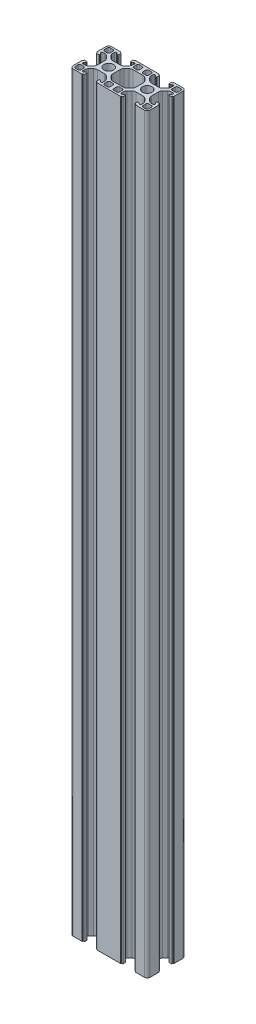
from build123d import *

# Parameters (mm, degrees)
EXTRUDE_1_DEPTH = 390


with BuildPart() as part:
    # Эскиз1 → Бобышка-Вытянуть1 (new body)
    with BuildSketch(Plane(origin=(0, 0, 0), x_dir=(1, 0, 0), z_dir=(0, 1, 0))):
        with BuildLine():
            Line((9.247825015, 4.683728486), (11.146605684, 4.683728486))
            ThreePointArc((11.146605684, 4.683728486), (11.911972549, 4.835969421), (12.560819246, 5.269514923))
            Line((12.560819246, 5.269514923), (13.862038577, 6.570734254))
            ThreePointArc((13.862038577, 6.570734254), (14.29558408, 7.219580952), (14.447825015, 7.984947817))
            Line((14.447825015, 7.984947817), (14.447825015, 8.883728486))
            ThreePointArc((14.447825015, 8.883728486), (14.301378405, 9.237281876), (13.947825015, 9.383728486))
            Line((13.947825015, 9.383728486), (13.844931796, 9.383728486))
            ThreePointArc((13.844931796, 9.383728486), (13.65359008, 9.345668252), (13.491378405, 9.237281876))
            Line((13.491378405, 9.237281876), (13.01104832, 8.75695179))
            ThreePointArc((13.01104832, 8.75695179), (12.929942482, 8.702758603), (12.834271624, 8.683728486))
            Line((12.834271624, 8.683728486), (12.547825015, 8.683728486))
            ThreePointArc((12.547825015, 8.683728486), (12.37104832, 8.75695179), (12.297825015, 8.933728486))
            Line((12.297825015, 8.933728486), (12.297825015, 10.082799306))
            ThreePointArc((12.297825015, 10.082799306), (12.341758998, 10.188865323), (12.447825015, 10.232799306))
            Line((12.447825015, 10.232799306), (12.947825015, 10.232799306))
            Line((12.947825015, 10.232799306), (12.947825015, 10.533728486))
            ThreePointArc((12.947825015, 10.533728486), (12.991758998, 10.639794503), (13.097825015, 10.683728486))
            Line((13.097825015, 10.683728486), (17.747825015, 10.683728486))
            ThreePointArc((17.747825015, 10.683728486), (18.808485187, 10.244388658), (19.247825015, 9.183728486))
            Line((19.247825015, 9.183728486), (19.247825015, 4.533728486))
            ThreePointArc((19.247825015, 4.533728486), (19.203891032, 4.427662469), (19.097825015, 4.383728486))
            Line((19.097825015, 4.383728486), (18.796895835, 4.383728486))
            Line((18.796895835, 4.383728486), (18.796895835, 3.883728486))
            ThreePointArc((18.796895835, 3.883728486), (18.752961853, 3.777662469), (18.646895835, 3.733728486))
            Line((18.646895835, 3.733728486), (17.497825015, 3.733728486))
            ThreePointArc((17.497825015, 3.733728486), (17.32104832, 3.80695179), (17.247825015, 3.983728486))
            Line((17.247825015, 3.983728486), (17.247825015, 4.270175095))
            ThreePointArc((17.247825015, 4.270175095), (17.266855132, 4.365845953), (17.32104832, 4.44695179))
            Line((17.32104832, 4.44695179), (17.801378405, 4.927281876))
            ThreePointArc((17.801378405, 4.927281876), (17.909764781, 5.089493551), (17.947825015, 5.280835267))
            Line((17.947825015, 5.280835267), (17.947825015, 5.383728486))
            ThreePointArc((17.947825015, 5.383728486), (17.801378405, 5.737281876), (17.447825015, 5.883728486))
            Line((17.447825015, 5.883728486), (16.549044346, 5.883728486))
            ThreePointArc((16.549044346, 5.883728486), (15.783677481, 5.731487551), (15.134830783, 5.297942048))
            Line((15.134830783, 5.297942048), (13.833611452, 3.996722717))
            ThreePointArc((13.833611452, 3.996722717), (13.40006595, 3.34787602), (13.247825015, 2.582509155))
            Line((13.247825015, 2.582509155), (13.247825015, 0.683728486))
            Line((13.247825015, 0.683728486), (13.247825015, -1.215052183))
            ThreePointArc((13.247825015, -1.215052183), (13.40006595, -1.980419048), (13.833611452, -2.629265746))
            Line((13.833611452, -2.629265746), (15.134830783, -3.930485077))
            ThreePointArc((15.134830783, -3.930485077), (15.783677481, -4.364030579), (16.549044346, -4.516271514))
            Line((16.549044346, -4.516271514), (17.447825015, -4.516271514))
            ThreePointArc((17.447825015, -4.516271514), (17.801378405, -4.369824905), (17.947825015, -4.016271514))
            Line((17.947825015, -4.016271514), (17.947825015, -3.913378295))
            ThreePointArc((17.947825015, -3.913378295), (17.909764781, -3.722036579), (17.801378405, -3.559824905))
            Line((17.801378405, -3.559824905), (17.32104832, -3.079494819))
            ThreePointArc((17.32104832, -3.079494819), (17.266855132, -2.998388982), (17.247825015, -2.902718124))
            Line((17.247825015, -2.902718124), (17.247825015, -2.616271514))
            ThreePointArc((17.247825015, -2.616271514), (17.32104832, -2.439494819), (17.497825015, -2.366271514))
            Line((17.497825015, -2.366271514), (18.646895835, -2.366271514))
            ThreePointArc((18.646895835, -2.366271514), (18.752961853, -2.410205497), (18.796895835, -2.516271514))
            Line((18.796895835, -2.516271514), (18.796895835, -3.016271514))
            Line((18.796895835, -3.016271514), (19.097825015, -3.016271514))
            ThreePointArc((19.097825015, -3.016271514), (19.203891032, -3.060205497), (19.247825015, -3.166271514))
            Line((19.247825015, -3.166271514), (19.247825015, -7.816271514))
            ThreePointArc((19.247825015, -7.816271514), (18.808485187, -8.876931686), (17.747825015, -9.316271514))
            Line((17.747825015, -9.316271514), (13.097825015, -9.316271514))
            ThreePointArc((13.097825015, -9.316271514), (12.991758998, -9.272337531), (12.947825015, -9.166271514))
            Line((12.947825015, -9.166271514), (12.947825015, -8.865342335))
            Line((12.947825015, -8.865342335), (12.447825015, -8.865342335))
            ThreePointArc((12.447825015, -8.865342335), (12.341758998, -8.821408352), (12.297825015, -8.715342335))
            Line((12.297825015, -8.715342335), (12.297825015, -7.566271514))
            ThreePointArc((12.297825015, -7.566271514), (12.37104832, -7.389494819), (12.547825015, -7.316271514))
            Line((12.547825015, -7.316271514), (12.834271624, -7.316271514))
            ThreePointArc((12.834271624, -7.316271514), (12.929942482, -7.335301631), (13.01104832, -7.389494819))
            Line((13.01104832, -7.389494819), (13.491378405, -7.869824905))
            ThreePointArc((13.491378405, -7.869824905), (13.65359008, -7.978211281), (13.844931796, -8.016271514))
            Line((13.844931796, -8.016271514), (13.947825015, -8.016271514))
            ThreePointArc((13.947825015, -8.016271514), (14.301378405, -7.869824905), (14.447825015, -7.516271514))
            Line((14.447825015, -7.516271514), (14.447825015, -6.617490845))
            ThreePointArc((14.447825015, -6.617490845), (14.29558408, -5.85212398), (13.862038577, -5.203277283))
            Line((13.862038577, -5.203277283), (12.560819246, -3.902057952))
            ThreePointArc((12.560819246, -3.902057952), (11.911972549, -3.468512449), (11.146605684, -3.316271514))
            Line((11.146605684, -3.316271514), (9.247825015, -3.316271514))
            Line((9.247825015, -3.316271514), (7.349044346, -3.316271514))
            ThreePointArc((7.349044346, -3.316271514), (6.583677481, -3.468512449), (5.934830783, -3.902057952))
            Line((5.934830783, -3.902057952), (4.633611452, -5.203277283))
            ThreePointArc((4.633611452, -5.203277283), (4.20006595, -5.85212398), (4.047825015, -6.617490845))
            Line((4.047825015, -6.617490845), (4.047825015, -7.516271514))
            ThreePointArc((4.047825015, -7.516271514), (4.194271624, -7.869824905), (4.547825015, -8.016271514))
            Line((4.547825015, -8.016271514), (4.650718234, -8.016271514))
            ThreePointArc((4.650718234, -8.016271514), (4.84205995, -7.978211281), (5.004271624, -7.869824905))
            Line((5.004271624, -7.869824905), (5.48460171, -7.389494819))
            ThreePointArc((5.48460171, -7.389494819), (5.565707547, -7.335301631), (5.661378405, -7.316271514))
            Line((5.661378405, -7.316271514), (5.947825015, -7.316271514))
            ThreePointArc((5.947825015, -7.316271514), (6.12460171, -7.389494819), (6.197825015, -7.566271514))
            Line((6.197825015, -7.566271514), (6.197825015, -8.715342335))
            ThreePointArc((6.197825015, -8.715342335), (6.153891032, -8.821408352), (6.047825015, -8.865342335))
            Line((6.047825015, -8.865342335), (5.547825015, -8.865342335))
            Line((5.547825015, -8.865342335), (5.547825015, -9.166271514))
            ThreePointArc((5.547825015, -9.166271514), (5.503891032, -9.272337531), (5.397825015, -9.316271514))
            Line((5.397825015, -9.316271514), (0.747825015, -9.316271514))
            Line((0.747825015, -9.316271514), (-2.252174985, -9.316271514))
            Line((-2.252174985, -9.316271514), (-6.902174985, -9.316271514))
            ThreePointArc((-6.902174985, -9.316271514), (-7.008241002, -9.272337531), (-7.052174985, -9.166271514))
            Line((-7.052174985, -9.166271514), (-7.052174985, -8.865342335))
            Line((-7.052174985, -8.865342335), (-7.552174985, -8.865342335))
            ThreePointArc((-7.552174985, -8.865342335), (-7.658241002, -8.821408352), (-7.702174985, -8.715342335))
            Line((-7.702174985, -8.715342335), (-7.702174985, -7.566271514))
            ThreePointArc((-7.702174985, -7.566271514), (-7.62895168, -7.389494819), (-7.452174985, -7.316271514))
            Line((-7.452174985, -7.316271514), (-7.165728376, -7.316271514))
            ThreePointArc((-7.165728376, -7.316271514), (-7.070057518, -7.335301631), (-6.98895168, -7.389494819))
            Line((-6.98895168, -7.389494819), (-6.508621595, -7.869824905))
            ThreePointArc((-6.508621595, -7.869824905), (-6.34640992, -7.978211281), (-6.155068204, -8.016271514))
            Line((-6.155068204, -8.016271514), (-6.052174985, -8.016271514))
            ThreePointArc((-6.052174985, -8.016271514), (-5.698621595, -7.869824905), (-5.552174985, -7.516271514))
            Line((-5.552174985, -7.516271514), (-5.552174985, -6.617490845))
            ThreePointArc((-5.552174985, -6.617490845), (-5.70441592, -5.85212398), (-6.137961423, -5.203277283))
            Line((-6.137961423, -5.203277283), (-7.439180754, -3.902057952))
            ThreePointArc((-7.439180754, -3.902057952), (-8.088027451, -3.468512449), (-8.853394316, -3.316271514))
            Line((-8.853394316, -3.316271514), (-10.752174985, -3.316271514))
            Line((-10.752174985, -3.316271514), (-12.650955654, -3.316271514))
            ThreePointArc((-12.650955654, -3.316271514), (-13.416322519, -3.468512449), (-14.065169217, -3.902057952))
            Line((-14.065169217, -3.902057952), (-15.366388548, -5.203277283))
            ThreePointArc((-15.366388548, -5.203277283), (-15.79993405, -5.85212398), (-15.952174985, -6.617490845))
            Line((-15.952174985, -6.617490845), (-15.952174985, -7.516271514))
            ThreePointArc((-15.952174985, -7.516271514), (-15.805728376, -7.869824905), (-15.452174985, -8.016271514))
            Line((-15.452174985, -8.016271514), (-15.349281766, -8.016271514))
            ThreePointArc((-15.349281766, -8.016271514), (-15.15794005, -7.978211281), (-14.995728376, -7.869824905))
            Line((-14.995728376, -7.869824905), (-14.51539829, -7.389494819))
            ThreePointArc((-14.51539829, -7.389494819), (-14.434292453, -7.335301631), (-14.338621595, -7.316271514))
            Line((-14.338621595, -7.316271514), (-14.052174985, -7.316271514))
            ThreePointArc((-14.052174985, -7.316271514), (-13.87539829, -7.389494819), (-13.802174985, -7.566271514))
            Line((-13.802174985, -7.566271514), (-13.802174985, -8.715342335))
            ThreePointArc((-13.802174985, -8.715342335), (-13.846108968, -8.821408352), (-13.952174985, -8.865342335))
            Line((-13.952174985, -8.865342335), (-14.452174985, -8.865342335))
            Line((-14.452174985, -8.865342335), (-14.452174985, -9.166271514))
            ThreePointArc((-14.452174985, -9.166271514), (-14.496108968, -9.272337531), (-14.602174985, -9.316271514))
            Line((-14.602174985, -9.316271514), (-19.252174985, -9.316271514))
            ThreePointArc((-19.252174985, -9.316271514), (-20.312835157, -8.876931686), (-20.752174985, -7.816271514))
            Line((-20.752174985, -7.816271514), (-20.752174985, -3.166271514))
            ThreePointArc((-20.752174985, -3.166271514), (-20.708241002, -3.060205497), (-20.602174985, -3.016271514))
            Line((-20.602174985, -3.016271514), (-20.301245806, -3.016271514))
            Line((-20.301245806, -3.016271514), (-20.301245806, -2.516271514))
            ThreePointArc((-20.301245806, -2.516271514), (-20.257311823, -2.410205497), (-20.151245806, -2.366271514))
            Line((-20.151245806, -2.366271514), (-19.002174985, -2.366271514))
            ThreePointArc((-19.002174985, -2.366271514), (-18.82539829, -2.439494819), (-18.752174985, -2.616271514))
            Line((-18.752174985, -2.616271514), (-18.752174985, -2.902718124))
            ThreePointArc((-18.752174985, -2.902718124), (-18.771205102, -2.998388982), (-18.82539829, -3.079494819))
            Line((-18.82539829, -3.079494819), (-19.305728376, -3.559824905))
            ThreePointArc((-19.305728376, -3.559824905), (-19.414114751, -3.722036579), (-19.452174985, -3.913378295))
            Line((-19.452174985, -3.913378295), (-19.452174985, -4.016271514))
            ThreePointArc((-19.452174985, -4.016271514), (-19.305728376, -4.369824905), (-18.952174985, -4.516271514))
            Line((-18.952174985, -4.516271514), (-18.053394316, -4.516271514))
            ThreePointArc((-18.053394316, -4.516271514), (-17.288027451, -4.364030579), (-16.639180754, -3.930485077))
            Line((-16.639180754, -3.930485077), (-15.337961423, -2.629265746))
            ThreePointArc((-15.337961423, -2.629265746), (-14.90441592, -1.980419048), (-14.752174985, -1.215052183))
            Line((-14.752174985, -1.215052183), (-14.752174985, 0.683728486))
            Line((-14.752174985, 0.683728486), (-14.752174985, 2.582509155))
            ThreePointArc((-14.752174985, 2.582509155), (-14.90441592, 3.34787602), (-15.337961423, 3.996722717))
            Line((-15.337961423, 3.996722717), (-16.639180754, 5.297942048))
            ThreePointArc((-16.639180754, 5.297942048), (-17.288027451, 5.731487551), (-18.053394316, 5.883728486))
            Line((-18.053394316, 5.883728486), (-18.952174985, 5.883728486))
            ThreePointArc((-18.952174985, 5.883728486), (-19.305728376, 5.737281876), (-19.452174985, 5.383728486))
            Line((-19.452174985, 5.383728486), (-19.452174985, 5.280835267))
            ThreePointArc((-19.452174985, 5.280835267), (-19.414114751, 5.089493551), (-19.305728376, 4.927281876))
            Line((-19.305728376, 4.927281876), (-18.82539829, 4.44695179))
            ThreePointArc((-18.82539829, 4.44695179), (-18.771205102, 4.365845953), (-18.752174985, 4.270175095))
            Line((-18.752174985, 4.270175095), (-18.752174985, 3.983728486))
            ThreePointArc((-18.752174985, 3.983728486), (-18.82539829, 3.80695179), (-19.002174985, 3.733728486))
            Line((-19.002174985, 3.733728486), (-20.151245806, 3.733728486))
            ThreePointArc((-20.151245806, 3.733728486), (-20.257311823, 3.777662469), (-20.301245806, 3.883728486))
            Line((-20.301245806, 3.883728486), (-20.301245806, 4.383728486))
            Line((-20.301245806, 4.383728486), (-20.602174985, 4.383728486))
            ThreePointArc((-20.602174985, 4.383728486), (-20.708241002, 4.427662469), (-20.752174985, 4.533728486))
            Line((-20.752174985, 4.533728486), (-20.752174985, 9.183728486))
            ThreePointArc((-20.752174985, 9.183728486), (-20.312835157, 10.244388658), (-19.252174985, 10.683728486))
            Line((-19.252174985, 10.683728486), (-14.602174985, 10.683728486))
            ThreePointArc((-14.602174985, 10.683728486), (-14.496108968, 10.639794503), (-14.452174985, 10.533728486))
            Line((-14.452174985, 10.533728486), (-14.452174985, 10.232799306))
            Line((-14.452174985, 10.232799306), (-13.952174985, 10.232799306))
            ThreePointArc((-13.952174985, 10.232799306), (-13.846108968, 10.188865323), (-13.802174985, 10.082799306))
            Line((-13.802174985, 10.082799306), (-13.802174985, 8.933728486))
            ThreePointArc((-13.802174985, 8.933728486), (-13.87539829, 8.75695179), (-14.052174985, 8.683728486))
            Line((-14.052174985, 8.683728486), (-14.338621595, 8.683728486))
            ThreePointArc((-14.338621595, 8.683728486), (-14.434292453, 8.702758603), (-14.51539829, 8.75695179))
            Line((-14.51539829, 8.75695179), (-14.995728376, 9.237281876))
            ThreePointArc((-14.995728376, 9.237281876), (-15.15794005, 9.345668252), (-15.349281766, 9.383728486))
            Line((-15.349281766, 9.383728486), (-15.452174985, 9.383728486))
            ThreePointArc((-15.452174985, 9.383728486), (-15.805728376, 9.237281876), (-15.952174985, 8.883728486))
            Line((-15.952174985, 8.883728486), (-15.952174985, 7.984947817))
            ThreePointArc((-15.952174985, 7.984947817), (-15.79993405, 7.219580952), (-15.366388548, 6.570734254))
            Line((-15.366388548, 6.570734254), (-14.065169217, 5.269514923))
            ThreePointArc((-14.065169217, 5.269514923), (-13.416322519, 4.835969421), (-12.650955654, 4.683728486))
            Line((-12.650955654, 4.683728486), (-10.752174985, 4.683728486))
            Line((-10.752174985, 4.683728486), (-8.853394316, 4.683728486))
            ThreePointArc((-8.853394316, 4.683728486), (-8.088027451, 4.835969421), (-7.439180754, 5.269514923))
            Line((-7.439180754, 5.269514923), (-6.137961423, 6.570734254))
            ThreePointArc((-6.137961423, 6.570734254), (-5.70441592, 7.219580952), (-5.552174985, 7.984947817))
            Line((-5.552174985, 7.984947817), (-5.552174985, 8.883728486))
            ThreePointArc((-5.552174985, 8.883728486), (-5.698621595, 9.237281876), (-6.052174985, 9.383728486))
            Line((-6.052174985, 9.383728486), (-6.155068204, 9.383728486))
            ThreePointArc((-6.155068204, 9.383728486), (-6.34640992, 9.345668252), (-6.508621595, 9.237281876))
            Line((-6.508621595, 9.237281876), (-6.98895168, 8.75695179))
            ThreePointArc((-6.98895168, 8.75695179), (-7.070057518, 8.702758603), (-7.165728376, 8.683728486))
            Line((-7.165728376, 8.683728486), (-7.452174985, 8.683728486))
            ThreePointArc((-7.452174985, 8.683728486), (-7.62895168, 8.75695179), (-7.702174985, 8.933728486))
            Line((-7.702174985, 8.933728486), (-7.702174985, 10.082799306))
            ThreePointArc((-7.702174985, 10.082799306), (-7.658241002, 10.188865323), (-7.552174985, 10.232799306))
            Line((-7.552174985, 10.232799306), (-7.052174985, 10.232799306))
            Line((-7.052174985, 10.232799306), (-7.052174985, 10.533728486))
            ThreePointArc((-7.052174985, 10.533728486), (-7.008241002, 10.639794503), (-6.902174985, 10.683728486))
            Line((-6.902174985, 10.683728486), (-2.252174985, 10.683728486))
            Line((-2.252174985, 10.683728486), (0.747825015, 10.683728486))
            Line((0.747825015, 10.683728486), (5.397825015, 10.683728486))
            ThreePointArc((5.397825015, 10.683728486), (5.503891032, 10.639794503), (5.547825015, 10.533728486))
            Line((5.547825015, 10.533728486), (5.547825015, 10.232799306))
            Line((5.547825015, 10.232799306), (6.047825015, 10.232799306))
            ThreePointArc((6.047825015, 10.232799306), (6.153891032, 10.188865323), (6.197825015, 10.082799306))
            Line((6.197825015, 10.082799306), (6.197825015, 8.933728486))
            ThreePointArc((6.197825015, 8.933728486), (6.12460171, 8.75695179), (5.947825015, 8.683728486))
            Line((5.947825015, 8.683728486), (5.661378405, 8.683728486))
            ThreePointArc((5.661378405, 8.683728486), (5.565707547, 8.702758603), (5.48460171, 8.75695179))
            Line((5.48460171, 8.75695179), (5.004271624, 9.237281876))
            ThreePointArc((5.004271624, 9.237281876), (4.84205995, 9.345668252), (4.650718234, 9.383728486))
            Line((4.650718234, 9.383728486), (4.547825015, 9.383728486))
            ThreePointArc((4.547825015, 9.383728486), (4.194271624, 9.237281876), (4.047825015, 8.883728486))
            Line((4.047825015, 8.883728486), (4.047825015, 7.984947817))
            ThreePointArc((4.047825015, 7.984947817), (4.20006595, 7.219580952), (4.633611452, 6.570734254))
            Line((4.633611452, 6.570734254), (5.934830783, 5.269514923))
            ThreePointArc((5.934830783, 5.269514923), (6.583677481, 4.835969421), (7.349044346, 4.683728486))
            Line((7.349044346, 4.683728486), (9.247825015, 4.683728486))
        make_face()
        with BuildLine():
            Line((16.147825015, 6.783728486), (17.547825015, 6.783728486))
            ThreePointArc((17.547825015, 6.783728486), (18.11351044, 7.018043061), (18.347825015, 7.583728486))
            Line((18.347825015, 7.583728486), (18.347825015, 8.983728486))
            ThreePointArc((18.347825015, 8.983728486), (18.11351044, 9.549413911), (17.547825015, 9.783728486))
            Line((17.547825015, 9.783728486), (16.147825015, 9.783728486))
            ThreePointArc((16.147825015, 9.783728486), (15.58213959, 9.549413911), (15.347825015, 8.983728486))
            Line((15.347825015, 8.983728486), (15.347825015, 7.583728486))
            ThreePointArc((15.347825015, 7.583728486), (15.58213959, 7.018043061), (16.147825015, 6.783728486))
        make_face(mode=Mode.SUBTRACT)
        with BuildLine():
            Line((15.347825015, -6.216271514), (15.347825015, -7.616271514))
            ThreePointArc((15.347825015, -7.616271514), (15.58213959, -8.181956939), (16.147825015, -8.416271514))
            Line((16.147825015, -8.416271514), (17.547825015, -8.416271514))
            ThreePointArc((17.547825015, -8.416271514), (18.11351044, -8.181956939), (18.347825015, -7.616271514))
            Line((18.347825015, -7.616271514), (18.347825015, -6.216271514))
            ThreePointArc((18.347825015, -6.216271514), (18.11351044, -5.650586089), (17.547825015, -5.416271514))
            Line((17.547825015, -5.416271514), (16.147825015, -5.416271514))
            ThreePointArc((16.147825015, -5.416271514), (15.58213959, -5.650586089), (15.347825015, -6.216271514))
        make_face(mode=Mode.SUBTRACT)
        with BuildLine():
            Line((2.347825015, -5.416271514), (0.947825015, -5.416271514))
            ThreePointArc((0.947825015, -5.416271514), (0.38213959, -5.650586089), (0.147825015, -6.216271514))
            Line((0.147825015, -6.216271514), (0.147825015, -7.616271514))
            ThreePointArc((0.147825015, -7.616271514), (0.38213959, -8.181956939), (0.947825015, -8.416271514))
            Line((0.947825015, -8.416271514), (2.347825015, -8.416271514))
            ThreePointArc((2.347825015, -8.416271514), (2.91351044, -8.181956939), (3.147825015, -7.616271514))
            Line((3.147825015, -7.616271514), (3.147825015, -6.216271514))
            ThreePointArc((3.147825015, -6.216271514), (2.91351044, -5.650586089), (2.347825015, -5.416271514))
        make_face(mode=Mode.SUBTRACT)
        with BuildLine():
            Line((1.047825015, -4.516271514), (1.946605684, -4.516271514))
            ThreePointArc((1.946605684, -4.516271514), (2.711972549, -4.364030579), (3.360819246, -3.930485077))
            Line((3.360819246, -3.930485077), (4.662038577, -2.629265746))
            ThreePointArc((4.662038577, -2.629265746), (5.09558408, -1.980419048), (5.247825015, -1.215052183))
            Line((5.247825015, -1.215052183), (5.247825015, 0.683728486))
            Line((5.247825015, 0.683728486), (5.247825015, 2.582509155))
            ThreePointArc((5.247825015, 2.582509155), (5.09558408, 3.34787602), (4.662038577, 3.996722717))
            Line((4.662038577, 3.996722717), (3.360819246, 5.297942048))
            ThreePointArc((3.360819246, 5.297942048), (2.711972549, 5.731487551), (1.946605684, 5.883728486))
            Line((1.946605684, 5.883728486), (1.047825015, 5.883728486))
            Line((1.047825015, 5.883728486), (-2.552174985, 5.883728486))
            Line((-2.552174985, 5.883728486), (-3.450955654, 5.883728486))
            ThreePointArc((-3.450955654, 5.883728486), (-4.216322519, 5.731487551), (-4.865169217, 5.297942048))
            Line((-4.865169217, 5.297942048), (-6.166388548, 3.996722717))
            ThreePointArc((-6.166388548, 3.996722717), (-6.59993405, 3.34787602), (-6.752174985, 2.582509155))
            Line((-6.752174985, 2.582509155), (-6.752174985, 0.683728486))
            Line((-6.752174985, 0.683728486), (-6.752174985, -1.215052183))
            ThreePointArc((-6.752174985, -1.215052183), (-6.59993405, -1.980419048), (-6.166388548, -2.629265746))
            Line((-6.166388548, -2.629265746), (-4.865169217, -3.930485077))
            ThreePointArc((-4.865169217, -3.930485077), (-4.216322519, -4.364030579), (-3.450955654, -4.516271514))
            Line((-3.450955654, -4.516271514), (-2.552174985, -4.516271514))
            Line((-2.552174985, -4.516271514), (1.047825015, -4.516271514))
        make_face(mode=Mode.SUBTRACT)
        with BuildLine():
            Line((3.147825015, 7.583728486), (3.147825015, 8.983728486))
            ThreePointArc((3.147825015, 8.983728486), (2.91351044, 9.549413911), (2.347825015, 9.783728486))
            Line((2.347825015, 9.783728486), (0.947825015, 9.783728486))
            ThreePointArc((0.947825015, 9.783728486), (0.38213959, 9.549413911), (0.147825015, 8.983728486))
            Line((0.147825015, 8.983728486), (0.147825015, 7.583728486))
            ThreePointArc((0.147825015, 7.583728486), (0.38213959, 7.018043061), (0.947825015, 6.783728486))
            Line((0.947825015, 6.783728486), (2.347825015, 6.783728486))
            ThreePointArc((2.347825015, 6.783728486), (2.91351044, 7.018043061), (3.147825015, 7.583728486))
        make_face(mode=Mode.SUBTRACT)
        with BuildLine():
            Line((-2.452174985, 9.783728486), (-3.852174985, 9.783728486))
            ThreePointArc((-3.852174985, 9.783728486), (-4.41786041, 9.549413911), (-4.652174985, 8.983728486))
            Line((-4.652174985, 8.983728486), (-4.652174985, 7.583728486))
            ThreePointArc((-4.652174985, 7.583728486), (-4.41786041, 7.018043061), (-3.852174985, 6.783728486))
            Line((-3.852174985, 6.783728486), (-2.452174985, 6.783728486))
            ThreePointArc((-2.452174985, 6.783728486), (-1.88648956, 7.018043061), (-1.652174985, 7.583728486))
            Line((-1.652174985, 7.583728486), (-1.652174985, 8.983728486))
            ThreePointArc((-1.652174985, 8.983728486), (-1.88648956, 9.549413911), (-2.452174985, 9.783728486))
        make_face(mode=Mode.SUBTRACT)
        with BuildLine():
            Line((-1.652174985, -7.616271514), (-1.652174985, -6.216271514))
            ThreePointArc((-1.652174985, -6.216271514), (-1.88648956, -5.650586089), (-2.452174985, -5.416271514))
            Line((-2.452174985, -5.416271514), (-3.852174985, -5.416271514))
            ThreePointArc((-3.852174985, -5.416271514), (-4.41786041, -5.650586089), (-4.652174985, -6.216271514))
            Line((-4.652174985, -6.216271514), (-4.652174985, -7.616271514))
            ThreePointArc((-4.652174985, -7.616271514), (-4.41786041, -8.181956939), (-3.852174985, -8.416271514))
            Line((-3.852174985, -8.416271514), (-2.452174985, -8.416271514))
            ThreePointArc((-2.452174985, -8.416271514), (-1.88648956, -8.181956939), (-1.652174985, -7.616271514))
        make_face(mode=Mode.SUBTRACT)
        with BuildLine():
            Line((-19.052174985, -8.416271514), (-17.652174985, -8.416271514))
            ThreePointArc((-17.652174985, -8.416271514), (-17.08648956, -8.181956939), (-16.852174985, -7.616271514))
            Line((-16.852174985, -7.616271514), (-16.852174985, -6.216271514))
            ThreePointArc((-16.852174985, -6.216271514), (-17.08648956, -5.650586089), (-17.652174985, -5.416271514))
            Line((-17.652174985, -5.416271514), (-19.052174985, -5.416271514))
            ThreePointArc((-19.052174985, -5.416271514), (-19.61786041, -5.650586089), (-19.852174985, -6.216271514))
            Line((-19.852174985, -6.216271514), (-19.852174985, -7.616271514))
            ThreePointArc((-19.852174985, -7.616271514), (-19.61786041, -8.181956939), (-19.052174985, -8.416271514))
        make_face(mode=Mode.SUBTRACT)
        with BuildLine():
            Line((-19.852174985, 8.983728486), (-19.852174985, 7.583728486))
            ThreePointArc((-19.852174985, 7.583728486), (-19.61786041, 7.018043061), (-19.052174985, 6.783728486))
            Line((-19.052174985, 6.783728486), (-17.652174985, 6.783728486))
            ThreePointArc((-17.652174985, 6.783728486), (-17.08648956, 7.018043061), (-16.852174985, 7.583728486))
            Line((-16.852174985, 7.583728486), (-16.852174985, 8.983728486))
            ThreePointArc((-16.852174985, 8.983728486), (-17.08648956, 9.549413911), (-17.652174985, 9.783728486))
            Line((-17.652174985, 9.783728486), (-19.052174985, 9.783728486))
            ThreePointArc((-19.052174985, 9.783728486), (-19.61786041, 9.549413911), (-19.852174985, 8.983728486))
        make_face(mode=Mode.SUBTRACT)
        with BuildLine():
            ThreePointArc((11.747825015, 0.683728486), (11.015591968, 2.451495439), (9.247825015, 3.183728486))
            ThreePointArc((9.247825015, 3.183728486), (7.480058062, 2.451495439), (6.747825015, 0.683728486))
            ThreePointArc((6.747825015, 0.683728486), (7.480058062, -1.084038467), (9.247825015, -1.816271514))
            ThreePointArc((9.247825015, -1.816271514), (11.015591968, -1.084038467), (11.747825015, 0.683728486))
        make_face(mode=Mode.SUBTRACT)
        with BuildLine():
            ThreePointArc((-10.752174985, 3.183728486), (-8.984408032, 2.451495439), (-8.252174985, 0.683728486))
            ThreePointArc((-8.252174985, 0.683728486), (-8.984408032, -1.084038467), (-10.752174985, -1.816271514))
            ThreePointArc((-10.752174985, -1.816271514), (-12.519941938, -1.084038467), (-13.252174985, 0.683728486))
            ThreePointArc((-13.252174985, 0.683728486), (-12.519941938, 2.451495439), (-10.752174985, 3.183728486))
        make_face(mode=Mode.SUBTRACT)
    extrude(amount=EXTRUDE_1_DEPTH)


solid = part.part
